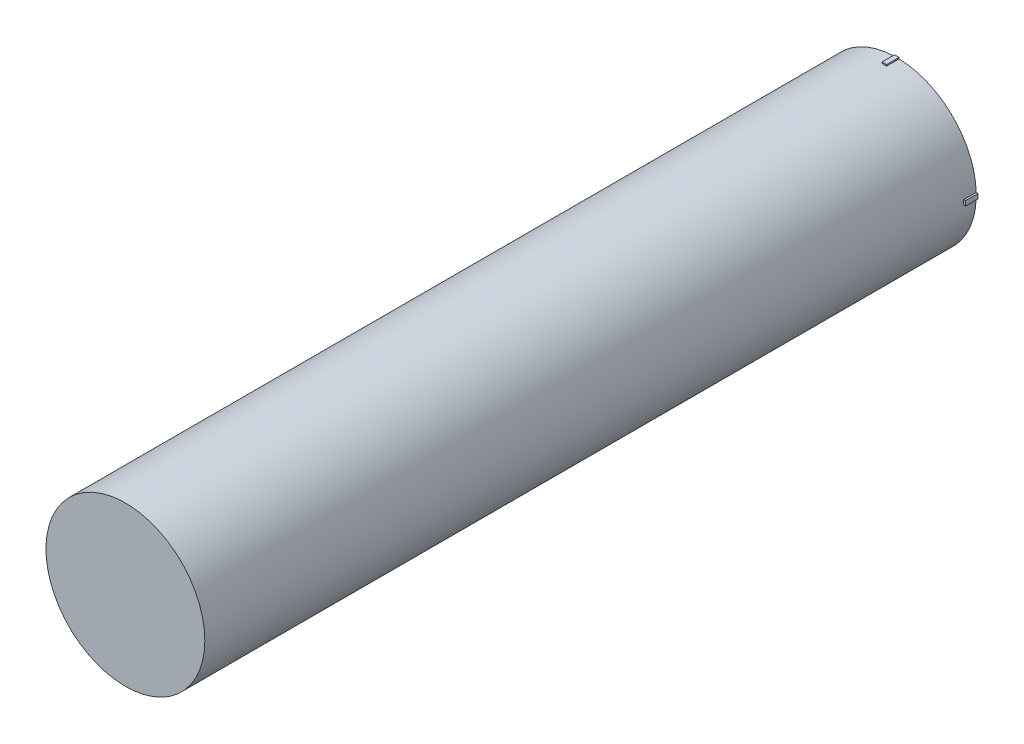
from build123d import *

# Parameters (mm, degrees)
CROQUIS1_R              = 19.05
SALIENTE_EXTRUIR1_DEPTH = 185
CROQUIS2_W              = 0.838589864
CROQUIS2_H              = 1.125731298
CROQUIS2_W_2            = 0.770363726
CROQUIS2_W_3            = 1.091618228
CROQUIS2_H_2            = 0.62827213
CROQUIS2_H_3            = 0.668024516
SALIENTE_EXTRUIR2_DEPTH = 3


with BuildPart() as part:
    # Croquis1 → Saliente-Extruir1 (new body)
    with BuildSketch(Plane.XY):
        Circle(CROQUIS1_R)
    extrude(amount=SALIENTE_EXTRUIR1_DEPTH)

    # Croquis2 → Saliente-Extruir2 (add)
    with BuildSketch(Plane(origin=(0, 0, 0), x_dir=(-1, 0, 0), z_dir=(0, 0, -1))):
        with Locations((-19.05, 0)):
            Rectangle(CROQUIS2_W, CROQUIS2_H)
        with Locations((19.05, 0)):
            Rectangle(CROQUIS2_W_2, CROQUIS2_H)
        with Locations((0, 19.05)):
            Rectangle(CROQUIS2_W_3, CROQUIS2_H_2)
        with Locations((0, -19.05)):
            Rectangle(CROQUIS2_W_3, CROQUIS2_H_3)
    extrude(amount=-SALIENTE_EXTRUIR2_DEPTH)


solid = part.part
